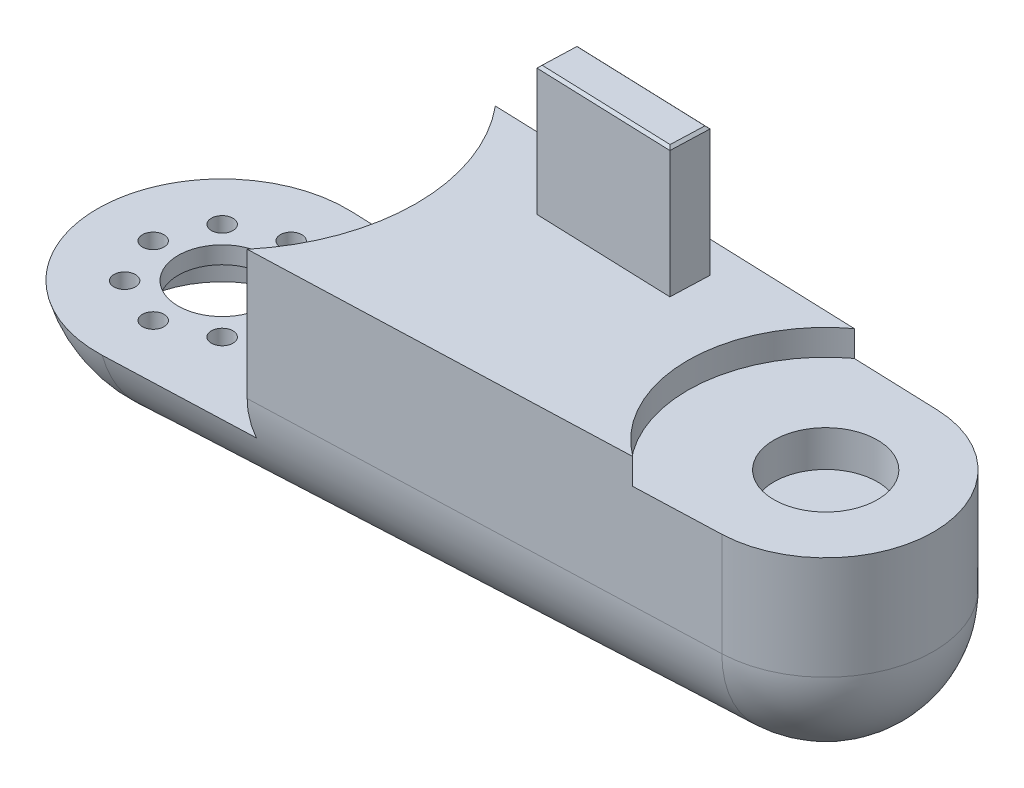
from build123d import *

# Parameters (mm, degrees)
EXTRUDE_1_DEPTH     = 15
REVOLVE_1_ANGLE     = 180.0000000000004
CUT_EXTRUDE_START   = -19
CUT_EXTRUDE_1_DEPTH = 19
SKETCH_5_R          = 10
CUT_EXTRUDE_2_DEPTH = 87.34958022017247
SKETCH_4_R          = 1.2499999999999991
SKETCH_4_R_2        = 1.2500000000000002
SKETCH_4_R_3        = 1.2499999999999996
SKETCH_4_R_4        = 1.2499999999999987
SKETCH_4_R_5        = 1.2499999999999984
SKETCH_4_R_6        = 1.249999999999999
SKETCH_4_R_7        = 5.1000000000000005
CUT_EXTRUDE_3_DEPTH = 86.88509768172823
CUT_EXTRUDE_START_2 = -3
CUT_EXTRUDE_5_DEPTH = 3
SKETCH_6_R          = 6.000000000000003
CUT_EXTRUDE_4_DEPTH = 4.2
EXTRUDE_2_DEPTH     = 15
CHAMFER_1_SIZE      = 0.3
HOLE_WIZARD_1_D     = 1.7
HOLE_WIZARD_1_DEPTH = 3.5


with BuildPart() as part:
    # 草图2 → 凸台-拉伸1 (new body)
    with BuildSketch(Plane(origin=(0, 0, 0), x_dir=(1, 0, 0), z_dir=(0, 1, 0))):
        with BuildLine():
            Line((70.44642857142858, 12.492025517529665), (0.5357142857142793, 14.990430621035568))
            ThreePointArc((0.5357142857142791, 14.990430621035566), (-10.41547612244118, 10.79434375693384), (-14.99999999999997, 1.22e-15))
            Line((-15, 0), (82.5, -8.67e-15))
            ThreePointArc((82.5, -8.44e-15), (78.99528646411157, 8.679563435367664), (70.44642857142858, 12.492025517529667))
        make_face()
        with BuildLine():
            Line((82.5, -8.67e-15), (-15, 0))
            ThreePointArc((-14.999999999999998, 0), (-10.415476122441204, -10.794343756933866), (0.535714285714286, -14.990430621035598))
            Line((0.5357142857142848, -14.990430621035598), (70.44642857142858, -12.492025517529669))
            ThreePointArc((70.44642857142858, -12.492025517529669), (78.99528646411156, -8.679563435367672), (82.5, -8.72e-15))
        make_face()
    extrude(amount=EXTRUDE_1_DEPTH)

    # 草图1 → 旋转1 (revolve)
    with BuildSketch(Plane(origin=(0, 0, 0), x_dir=(1, 0, 0), z_dir=(0, 1, 0))):
        with BuildLine():
            Line((0.5357142857142848, -14.990430621035598), (70.44642857142858, -12.492025517529669))
            ThreePointArc((70.44642857142858, -12.492025517529669), (78.99528646411156, -8.67956343536767), (82.5, 0))
            Line((82.5, 0), (-15, 0))
            ThreePointArc((-15, 0), (-10.415476122441207, -10.794343756933864), (0.5357142857142848, -14.990430621035598))
        make_face()
    revolve(axis=Axis((70, 0, 8.67e-15), (1, 0, 1.2e-16)), revolution_arc=REVOLVE_1_ANGLE)

    # 草图3 → 切除-拉伸1 (cut)
    with BuildSketch(Plane(origin=(0, 15, 0), x_dir=(1, 0, 0), z_dir=(0, 1, 0)).offset(CUT_EXTRUDE_START)):
        with BuildLine():
            Line((17.295525226029294, 14.391483841348133), (0.5357142857142793, 14.990430621035568))
            ThreePointArc((0.5357142857142793, 14.990430621035568), (-14.999999999999972, 1.84e-15), (0.5357142857142814, -14.990430621035584))
            Line((0.5357142857142814, -14.990430621035584), (17.29552522602928, -14.391483841348148))
            ThreePointArc((17.29552522602928, -14.391483841348148), (22.5, -9.99e-15), (17.295525226029294, 14.391483841348133))
        make_face()
    extrude(amount=CUT_EXTRUDE_1_DEPTH, mode=Mode.SUBTRACT)

    # 草图5 → 切除-拉伸2 (cut, through all)
    with BuildSketch(Plane(origin=(0, -6, 0), x_dir=(1, 0, 0), z_dir=(0, 1, 0))):
        with Locations(Location((0, 0, 0), (0, 0, 270))):
            Circle(SKETCH_5_R)
    extrude(amount=-CUT_EXTRUDE_2_DEPTH, mode=Mode.SUBTRACT)

    # 草图4 → 切除-拉伸3 (cut, through all)
    with BuildSketch(Plane(origin=(0, -4, 0), x_dir=(1, 0, 0), z_dir=(0, 1, 0))):
        with Locations(Location((8, 0, 0), (0, 0, 270))):
            Circle(SKETCH_4_R)
        with Locations(Location((5.656854249492371, -5.656854249492391, 0), (0, 0, 270))):
            Circle(SKETCH_4_R_2)
        with Locations(Location((-2.793e-14, -8, 0), (0, 0, 270))):
            Circle(SKETCH_4_R_3)
        with Locations(Location((-5.656854249492411, -5.65685424949235, 0), (0, 0, 270))):
            Circle(SKETCH_4_R_4)
        with Locations(Location((-8, 5.586e-14, 0), (0, 0, 270))):
            Circle(SKETCH_4_R_5)
        with Locations(Location((-5.65685424949233, 5.656854249492429, 0), (0, 0, 270))):
            Circle(SKETCH_4_R_3)
        with Locations(Location((8.38e-14, 7.999999999999998, 0), (0, 0, 270))):
            Circle(SKETCH_4_R_6)
        with Locations(Location((5.656854249492451, 5.656854249492311, 0), (0, 0, 270))):
            Circle(SKETCH_4_R_6)
        with Locations(Location((0, 0, 0), (0, 0, 270))):
            Circle(SKETCH_4_R_7)
    extrude(amount=-CUT_EXTRUDE_3_DEPTH, mode=Mode.SUBTRACT)

    # 草图11 → 切除-拉伸5 (cut)
    with BuildSketch(Plane(origin=(0, 15, 0), x_dir=(1, 0, 0), z_dir=(0, 1, 0)).offset(CUT_EXTRUDE_START_2)):
        with BuildLine():
            Line((60.46530800021301, 12.848721666733917), (70.44642857142858, 12.492025517529665))
            ThreePointArc((70.44642857142858, 12.492025517529665), (82.5, -8.67e-15), (70.44642857142858, -12.492025517529669))
            Line((70.44642857142858, -12.492025517529669), (60.46530800021299, -12.848721666733926))
            ThreePointArc((60.46530800021299, -12.848721666733926), (54, 3.9e-16), (60.46530800021301, 12.848721666733917))
        make_face()
    extrude(amount=CUT_EXTRUDE_5_DEPTH, mode=Mode.SUBTRACT)

    # 草图6 → 切除-拉伸4 (cut)
    with BuildSketch(Plane(origin=(0, 12, 0), x_dir=(1, 0, 0), z_dir=(0, 1, 0))):
        with Locations(Location((70, -8.67e-15, 0), (0, 0, 270))):
            Circle(SKETCH_6_R)
    extrude(amount=-CUT_EXTRUDE_4_DEPTH, mode=Mode.SUBTRACT)

    # 草图12 → 凸台-拉伸2 (add)
    with BuildSketch(Plane(origin=(0, 15, 0), x_dir=(1, 0, 0), z_dir=(0, 1, 0))):
        Polygon((38.755416613121156, 10.122335609132724), (38.59470232740688, 5.625206422822045), (46.58959865862586, 5.339492137107765), (46.750312944340145, 9.836621323418441), align=None)
        Polygon((30.760520281902174, 10.408049894847004), (30.59980599618789, 5.910920708536326), (38.59470232740688, 5.625206422822045), (38.755416613121156, 10.122335609132724), align=None)
    extrude(amount=EXTRUDE_2_DEPTH)

    # 倒角1
    chamfer_1_edges = [part.edges().sort_by_distance(p)[0] for p in [
        (38.755416613121156, 30, -10.122335609132723),
        (30.680163139045032, 30, -8.159485301691664),
        (38.59470232740688, 30, -5.625206422822045),
        (46.669955801483, 30, -7.588056730263103),
    ]]
    chamfer(chamfer_1_edges, length=CHAMFER_1_SIZE)

    # 孔1
    with Locations(Plane(origin=(0.41071428571427876, 0, -11.492663476127266), x_dir=(-0.9993620414023731, 0, -0.03571428571428518), z_dir=(0.03571428571428518, 0, -0.9993620414023731))):
        with Locations((-41.369180272, 27.499999998), (-35.369180272, 27.499999998)):
            Hole(HOLE_WIZARD_1_D / 2, depth=HOLE_WIZARD_1_DEPTH)


solid = part.part
